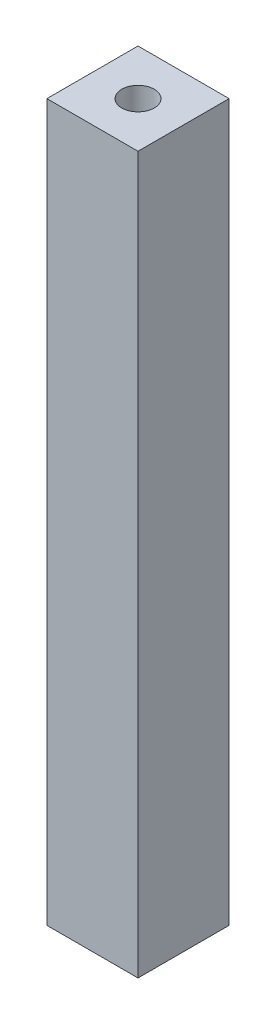
from build123d import *

# Parameters (mm, degrees)
BOSS_EXTRUDE1_DEPTH = 55
SKETCH2_R           = 1.25
CUT_EXTRUDE1_DEPTH  = 12
CUT_EXTRUDE2_START  = -12
SKETCH3_R           = 1.25
CUT_EXTRUDE2_DEPTH  = 12


with BuildPart() as part:
    # Sketch1 → Boss-Extrude1 (new body)
    with BuildSketch(Plane(origin=(0, 0, 0), x_dir=(1, 0, 0), z_dir=(0, 1, 0))):
        Polygon((0, 3.5), (-3.5, 3.5), (-3.5, -3.5), (3.5, -3.5), (3.5, 3.5), align=None)
    extrude(amount=BOSS_EXTRUDE1_DEPTH)

    # Sketch2 → Cut-Extrude1 (cut)
    with BuildSketch(Plane(origin=(0, 55, 0), x_dir=(1, 0, 0), z_dir=(0, 1, 0))):
        with Locations(Location((0, 0, 0), (0, 0, 270))):
            Circle(SKETCH2_R)
    extrude(amount=-CUT_EXTRUDE1_DEPTH, mode=Mode.SUBTRACT)

    # Sketch3 → Cut-Extrude2 (cut)
    with BuildSketch(Plane.XZ.offset(CUT_EXTRUDE2_START)):
        with Locations(Location((0, 0, 0), (0, 0, 90))):
            Circle(SKETCH3_R)
    extrude(amount=CUT_EXTRUDE2_DEPTH, mode=Mode.SUBTRACT)


solid = part.part
